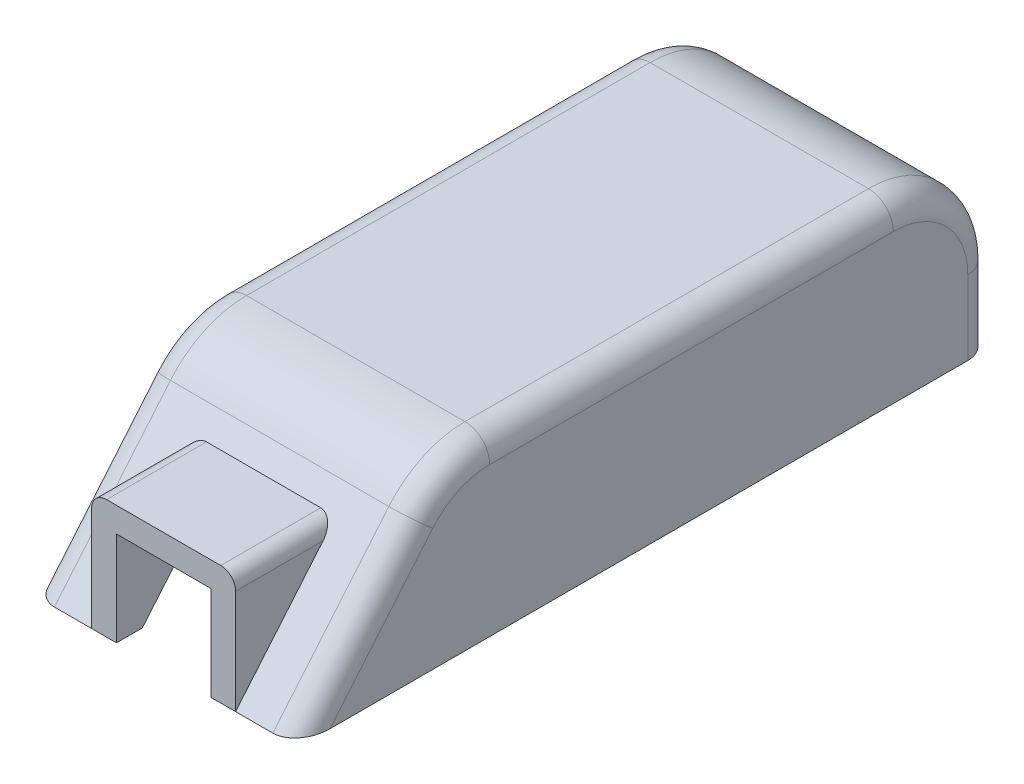
from build123d import *

# Parameters (mm, degrees)
BOSS_EXTRUDE1_DEPTH = 54
FILLET1_R           = 20
FILLET2_R           = 5
SHELL1_T            = -4
BOSS_EXTRUDE2_REACH = 156.081
SKETCH2_W           = 29
SKETCH2_H           = 24
SKETCH3_W           = 19
SKETCH3_H           = 19
CUT_EXTRUDE1_DEPTH  = 54
FILLET3_R           = 3


with BuildPart() as part:
    # Sketch1 → Boss-Extrude1 (new body)
    with BuildSketch(Plane(origin=(0, 0, 0), x_dir=(0, 0, -1), z_dir=(1, 0, 0))):
        Polygon((0, 0), (29.368487091, 35), (140, 35), (140, 0), align=None)
    extrude(amount=BOSS_EXTRUDE1_DEPTH)

    # Fillet1
    fillet1_edges = [part.edges().sort_by_distance(p)[0] for p in [
        (27, 35, -29.368487091),
        (27, 35, -140),
    ]]
    fillet(fillet1_edges, radius=FILLET1_R)

    # Fillet2
    fillet2_edges = [part.edges().sort_by_distance(p)[0] for p in [
        (0, 35, -79.347320127),
        (54, 35, -79.347320127),
        (0, 13.927876097, -11.686875696),
        (0, 33.126155741, -30.242275019),
        (0, 29.142135624, -134.142135624),
        (54, 13.927876097, -11.686875696),
        (54, 33.126155741, -30.242275019),
        (54, 29.142135624, -134.142135624),
        (0, 7.5, -140),
        (54, 7.5, -140),
    ]]
    fillet(fillet2_edges, radius=FILLET2_R)

    # Shell1
    shell1_openings = [part.faces().sort_by_distance(p)[0] for p in [
        (27, 0, -70.029322897),
    ]]
    offset(amount=SHELL1_T, openings=shell1_openings, kind=Kind.INTERSECTION)

    # Boss-Extrude2: up to this face of the body (flat: up to its plane)
    boss_extrude2_end = Plane(part.part.faces().sort_by_distance((27, 13.927876097, -11.686875696))[0])
    # Sketch2 → Boss-Extrude2 (add, up to the picked face)
    with BuildSketch(Plane.XY, mode=Mode.PRIVATE) as boss_extrude2_sk1:
        with Locations((27, 12)):
            Rectangle(SKETCH2_W, SKETCH2_H)
    boss_extrude2_tool1 = split(extrude(boss_extrude2_sk1.sketch, amount=-BOSS_EXTRUDE2_REACH, mode=Mode.PRIVATE), bisect_by=boss_extrude2_end, keep=Keep.BOTH, mode=Mode.PRIVATE)
    add(boss_extrude2_tool1.solids().sort_by(Axis((27, 12, 0), (0, 0, -1)))[0])

    # Sketch3 → Cut-Extrude1 (cut)
    with BuildSketch(Plane.XY):
        with Locations((27, 9.5)):
            Rectangle(SKETCH3_W, SKETCH3_H)
    extrude(amount=-CUT_EXTRUDE1_DEPTH, mode=Mode.SUBTRACT)

    # Fillet3
    fillet3_edges = [part.edges().sort_by_distance(p)[0] for p in [
        (41.5, 24, -10.069195574),
        (12.5, 24, -10.069195574),
    ]]
    fillet(fillet3_edges, radius=FILLET3_R)


solid = part.part
